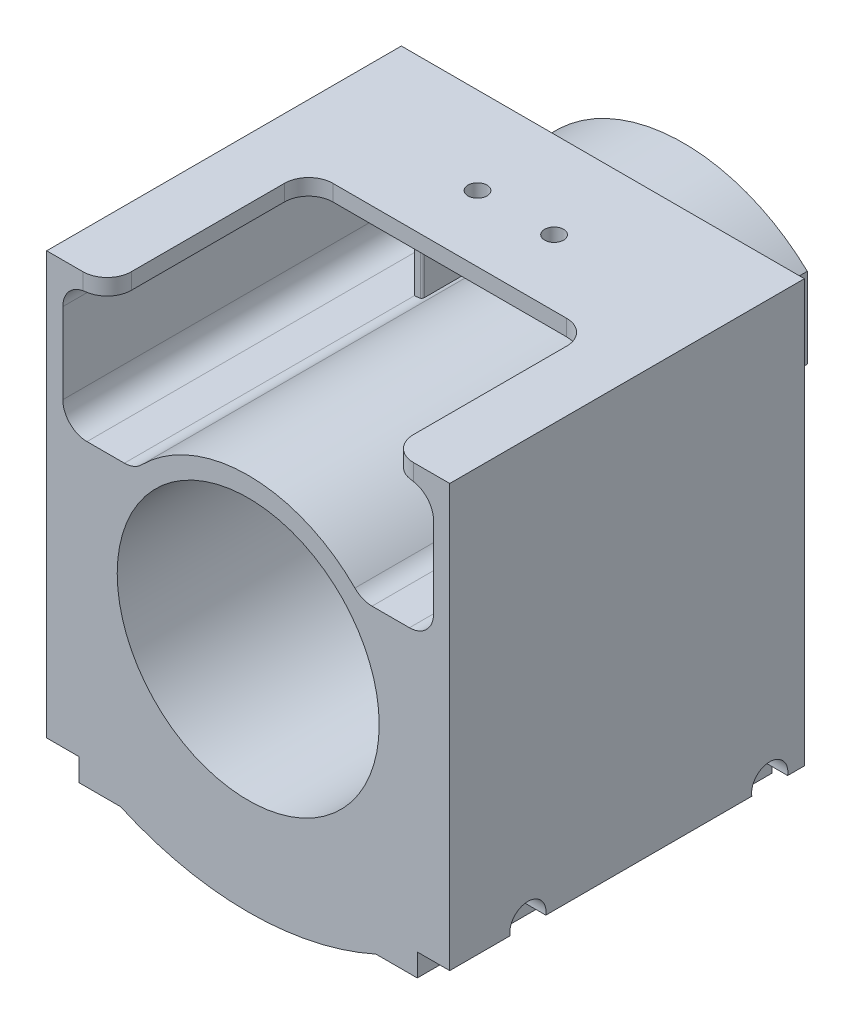
from build123d import *

# Parameters (mm, degrees)
BOSS_EXTRUDE2_START      = 6
BOSS_EXTRUDE2_DEPTH      = 44
CUT_EXTRUDE1_DEPTH       = 64.616841
CUT_EXTRUDE1_DEPTH_BACK  = 64.616841
SKETCH2_R                = 16.25
CUT_EXTRUDE3_DEPTH       = 64.616841
FILLET1_R                = 3
SKETCH5_W                = 35
SKETCH5_H                = 25
CUT_EXTRUDE4_DEPTH       = 10
FILLET2_R                = 3
SKETCH6_R                = 16.25
SKETCH6_R_2              = 9.5
SKETCH6_R_3              = 1.65
BOSS_EXTRUDE3_DEPTH      = 5
CUT_EXTRUDE5_DEPTH       = 68.905099
CUT_EXTRUDE5_DEPTH_BACK  = 68.905099
SKETCH7_R                = 2.25
CUT_EXTRUDE6_REACH       = 82.951
SKETCH8_R                = 1.175
BOSS_EXTRUDE4_DEPTH      = 8
BOSS_EXTRUDE4_DEPTH_BACK = 10
BOSS_EXTRUDE4_START      = -44
FILLET5_R                = 0.25
FILLET6_R                = 0.25


with BuildPart() as part:
    # Sketch1 → Boss-Extrude2 (new body)
    with BuildSketch(Plane.XY.offset(BOSS_EXTRUDE2_START)):
        with BuildLine():
            Line((-25, 0), (-25, -29.344548))
            Line((-25, -29.344548), (-25, -32.344548))
            Line((-25, -32.344548), (-20.974573, -32.344548))
            Line((-20.974573, -32.344548), (-20.974573, -35.144548))
            Line((-20.974573, -35.144548), (-15.841819, -35.144548))
            ThreePointArc((-15.841819, -35.144548), (0, -38.55), (15.841819, -35.144548))
            Line((15.841819, -35.144548), (20.974573, -35.144548))
            Line((20.974573, -35.144548), (20.974573, -32.344548))
            Line((20.974573, -32.344548), (25, -32.344548))
            Line((25, -32.344548), (25, -29.344548))
            Line((25, -29.344548), (25, 0))
            Line((25, 0), (25, 20))
            Line((25, 20), (-25, 20))
            Line((-25, 20), (-25, 0))
        make_face()
    extrude(amount=BOSS_EXTRUDE2_DEPTH)

    # Sketch2 → Cut-Extrude1 (cut, two sides: drawn at the far end of the back side and taken through both)
    with BuildSketch(Plane.XY.offset(50).offset(-CUT_EXTRUDE1_DEPTH_BACK)):
        with Locations((0, -10.3)):
            Circle(SKETCH2_R)
    extrude(amount=CUT_EXTRUDE1_DEPTH + CUT_EXTRUDE1_DEPTH_BACK, mode=Mode.SUBTRACT)

    # Sketch4 → Cut-Extrude3 (cut, through all)
    with BuildSketch(Plane.XY.offset(50)):
        with BuildLine():
            Line((-23, 18), (23, 18))
            Line((23, 18), (23, 2))
            Line((23, 2), (14.060939, 2))
            ThreePointArc((14.060939, 2), (0, 8.381542), (-14.060939, 2))
            Line((-14.060939, 2), (-23, 2))
            Line((-23, 2), (-23, 18))
        make_face()
    extrude(amount=-CUT_EXTRUDE3_DEPTH, mode=Mode.SUBTRACT)

    # Fillet1
    fillet1_edges = [part.edges().sort_by_distance(p)[0] for p in [
        (23, 18, 28),
        (23, 2, 28),
        (14.060939, 2, 28),
        (-14.060939, 2, 28),
        (-23, 2, 28),
        (-23, 18, 28),
    ]]
    fillet(fillet1_edges, radius=FILLET1_R)

    # Sketch5 → Cut-Extrude4 (cut)
    with BuildSketch(Plane(origin=(0, 20, 0), x_dir=(1, 0, 0), z_dir=(0, 1, 0))):
        with Locations((0, -37.5)):
            Rectangle(SKETCH5_W, SKETCH5_H)
    extrude(amount=-CUT_EXTRUDE4_DEPTH, mode=Mode.SUBTRACT)

    # Fillet2
    fillet2_edges = [part.edges().sort_by_distance(p)[0] for p in [
        (17.5, 19, 50),
        (17.5, 19, 25),
        (-17.5, 19, 25),
        (-17.5, 19, 50),
    ]]
    fillet(fillet2_edges, radius=FILLET2_R)

    # Sketch6 → Boss-Extrude3 (add)
    with BuildSketch(Plane.XY.offset(14)):
        with Locations((0, -10.3)):
            Circle(SKETCH6_R)
        with Locations((0, -10.3)):
            Circle(SKETCH6_R_2, mode=Mode.SUBTRACT)
        with Locations((4.446262, 1.916004)):
            Circle(SKETCH6_R_3, mode=Mode.SUBTRACT)
        with Locations((12.216004, -14.746262)):
            Circle(SKETCH6_R_3, mode=Mode.SUBTRACT)
        with Locations((-4.446262, -22.516004)):
            Circle(SKETCH6_R_3, mode=Mode.SUBTRACT)
        with Locations((-12.216004, -5.853738)):
            Circle(SKETCH6_R_3, mode=Mode.SUBTRACT)
    extrude(amount=-BOSS_EXTRUDE3_DEPTH)

    # Sketch7 → Cut-Extrude5 (cut, two sides: drawn at the far end of the back side and taken through both)
    with BuildSketch(Plane(origin=(0, 0, 0), x_dir=(0, 0, -1), z_dir=(1, 0, 0)).offset(-CUT_EXTRUDE5_DEPTH_BACK)):
        with Locations(Location((-40.3, -32, 0), (0, 0, 351.191499))):
            Circle(SKETCH7_R)
        with Locations(Location((-10.3, -32, 0), (0, 0, 351.191499))):
            Circle(SKETCH7_R)
    extrude(amount=CUT_EXTRUDE5_DEPTH + CUT_EXTRUDE5_DEPTH_BACK, mode=Mode.SUBTRACT)

    # Sketch8 → Cut-Extrude6 (cut, up to next)
    with BuildSketch(Plane(origin=(0, 20, 0), x_dir=(1, 0, 0), z_dir=(0, 1, 0)), mode=Mode.PRIVATE) as cut_extrude6_sk1:
        with Locations(Location((-4.75, -16.8, 0), (0, 0, 180))):
            Circle(SKETCH8_R)
    cut_extrude6_tool1 = extrude(cut_extrude6_sk1.sketch, amount=-CUT_EXTRUDE6_REACH, mode=Mode.PRIVATE) & part.part
    # Sketch8 → Cut-Extrude6 (cut, up to next)
    with BuildSketch(Plane(origin=(0, 20, 0), x_dir=(1, 0, 0), z_dir=(0, 1, 0)), mode=Mode.PRIVATE) as cut_extrude6_sk2:
        with Locations(Location((4.75, -16.8, 0), (0, 0, 180))):
            Circle(SKETCH8_R)
    cut_extrude6_tool2 = extrude(cut_extrude6_sk2.sketch, amount=-CUT_EXTRUDE6_REACH, mode=Mode.PRIVATE) & part.part
    add(cut_extrude6_tool1.solids().sort_by_distance((-4.75, 20, 16.8))[0], mode=Mode.SUBTRACT)
    add(cut_extrude6_tool2.solids().sort_by_distance((4.75, 20, 16.8))[0], mode=Mode.SUBTRACT)

    # Sketch9 → Boss-Extrude4 (add, two sides: drawn at the far end of the back side and taken through both)
    with BuildSketch(Plane.XY.offset(50).offset(BOSS_EXTRUDE4_START - BOSS_EXTRUDE4_DEPTH_BACK)):
        with BuildLine():
            Line((15.362267, 1), (15.362267, 10.976798))
            ThreePointArc((15.362267, 10.976798), (0, 17.081542), (-15.362267, 10.976798))
            Line((-15.362267, 10.976798), (-15.362267, 1))
            ThreePointArc((-15.362267, 1), (-13.827782, 1.306038), (-12.528102, 2.177322))
            ThreePointArc((-12.528102, 2.177322), (0, 7.381542), (12.528102, 2.177322))
            ThreePointArc((12.528102, 2.177322), (13.827782, 1.306038), (15.362267, 1))
        make_face()
        with BuildLine():
            ThreePointArc((-13.236643, 2.882992), (-13.759485, 2.464041), (-14.362267, 2.171573))
            Line((-14.362267, 2.171573), (-14.362267, 10.090161))
            ThreePointArc((-14.362267, 10.090161), (-14.272104, 10.505127), (-14.017873, 10.845264))
            ThreePointArc((-14.017873, 10.845264), (0, 16.081542), (14.017873, 10.845264))
            ThreePointArc((14.017873, 10.845264), (14.272104, 10.505127), (14.362267, 10.090161))
            Line((14.362267, 10.090161), (14.362267, 2.171573))
            ThreePointArc((14.362267, 2.171573), (13.759485, 2.464041), (13.236643, 2.882992))
            ThreePointArc((13.236643, 2.882992), (0, 8.381542), (-13.236643, 2.882992))
        make_face(mode=Mode.SUBTRACT)
    extrude(amount=BOSS_EXTRUDE4_DEPTH + BOSS_EXTRUDE4_DEPTH_BACK)

    # Fillet5
    fillet5_edges = [part.edges().sort_by_distance(p)[0] for p in [
        (0, 8.381542, -4),
        (14.272104, 10.505127, -4),
        (0, 16.081542, -4),
        (-14.272104, 10.505127, -4),
        (-13.759485, 2.464041, -4),
        (13.759485, 2.464041, -4),
        (14.362267, 6.130867, -4),
        (-14.362267, 6.130867, -4),
    ]]
    fillet(fillet5_edges, radius=FILLET5_R)

    # Fillet6
    fillet6_edges = [part.edges().sort_by_distance(p)[0] for p in [
        (-14.362267, 6.130867, 14),
        (0, 16.081542, 14),
        (14.272104, 10.505127, 14),
        (14.362267, 6.130867, 14),
        (-14.272104, 10.505127, 14),
    ]]
    fillet(fillet6_edges, radius=FILLET6_R)


solid = part.part
